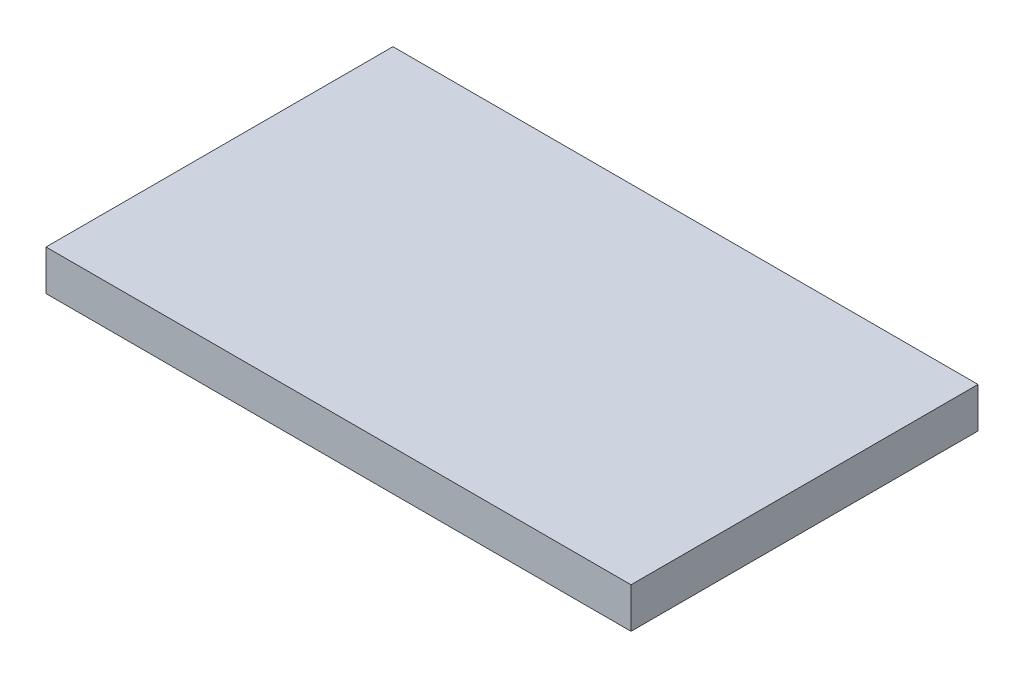
from build123d import *

# Parameters (mm, degrees)
SKETCH1_W           = 145
SKETCH1_H           = 86
BOSS_EXTRUDE1_DEPTH = 10


with BuildPart() as part:
    # Sketch1 → Boss-Extrude1 (new body)
    with BuildSketch(Plane(origin=(0, 0, 0), x_dir=(1, 0, 0), z_dir=(0, 1, 0))):
        with Locations((72.5, 43)):
            Rectangle(SKETCH1_W, SKETCH1_H)
    extrude(amount=BOSS_EXTRUDE1_DEPTH)


solid = part.part
